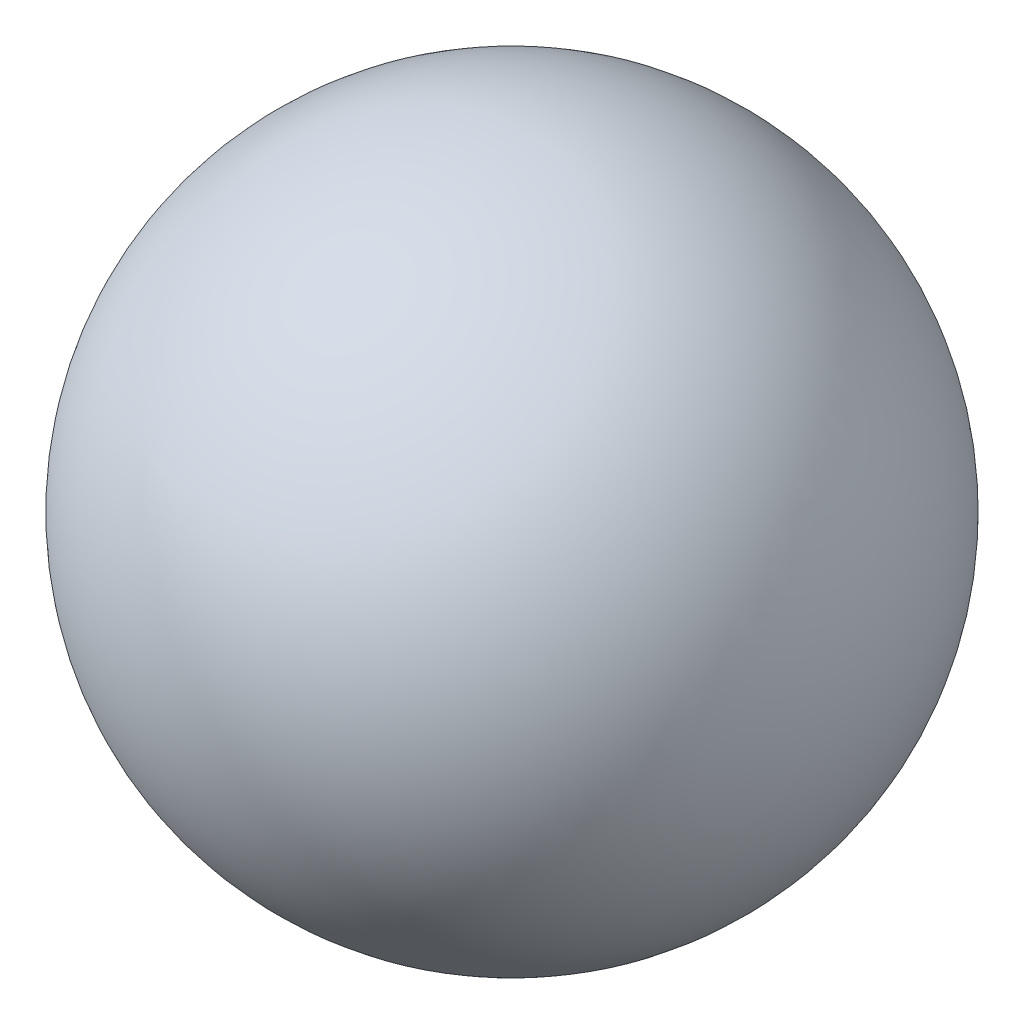
from build123d import *


with BuildPart() as part:
    # Sketch1 → Revolve1 (revolve)
    with BuildSketch(Plane.XY):
        with BuildLine():
            Line((0, 1.86), (0, -1.86))
            ThreePointArc((0, -1.86), (1.86, 0), (0, 1.86))
        make_face()
    revolve(axis=Axis((0, 0, 0), (0, 1, 0)))


solid = part.part
